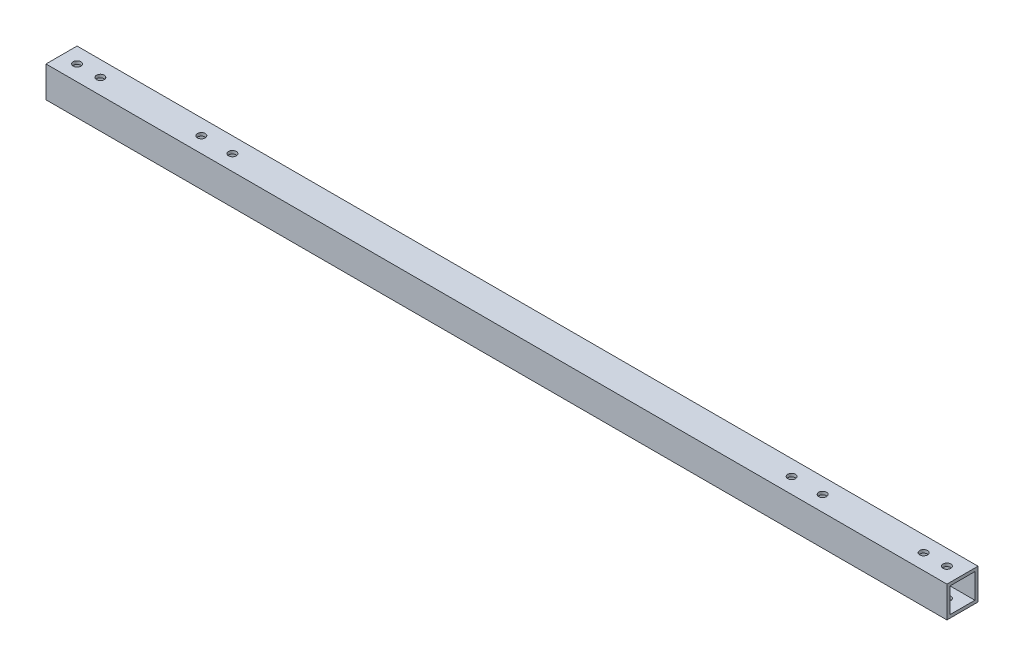
from build123d import *

# Parameters (mm, degrees)
SKETCH1_W           = 20
SKETCH1_H           = 20
SKETCH1_W_2         = 16
SKETCH1_H_2         = 16
BOSS_EXTRUDE1_DEPTH = 580
SKETCH2_R           = 2.5
CUT_EXTRUDE1_DEPTH  = 581.430874437
SKETCH3_R           = 2.5
CUT_EXTRUDE2_DEPTH  = 581.430874437


with BuildPart() as part:
    # Sketch1 → Boss-Extrude1 (new body)
    with BuildSketch(Plane(origin=(0, 0, 0), x_dir=(0, 0, -1), z_dir=(1, 0, 0))):
        Rectangle(SKETCH1_W, SKETCH1_H)
        Rectangle(SKETCH1_W_2, SKETCH1_H_2, mode=Mode.SUBTRACT)
    extrude(amount=BOSS_EXTRUDE1_DEPTH)

    # Sketch2 → Cut-Extrude1 (cut, through all)
    with BuildSketch(Plane(origin=(0, 10, 0), x_dir=(1, 0, 0), z_dir=(0, 1, 0))):
        with Locations(Location((10, 0, 0), (0, 0, 270))):
            Circle(SKETCH2_R)
        with Locations(Location((570, 0, 0), (0, 0, 270))):
            Circle(SKETCH2_R)
        with Locations(Location((25, 0, 0), (0, 0, 270))):
            Circle(SKETCH2_R)
        with Locations(Location((555, 0, 0), (0, 0, 270))):
            Circle(SKETCH2_R)
    extrude(amount=-CUT_EXTRUDE1_DEPTH, mode=Mode.SUBTRACT)

    # Sketch3 → Cut-Extrude2 (cut, through all)
    with BuildSketch(Plane(origin=(0, 10, 0), x_dir=(1, 0, 0), z_dir=(0, 1, 0))):
        with Locations(Location((110, 0, 0), (0, 0, 270))):
            Circle(SKETCH3_R)
        with Locations(Location((90, 0, 0), (0, 0, 270))):
            Circle(SKETCH3_R)
        with Locations(Location((490, 0, 0), (0, 0, 270))):
            Circle(SKETCH3_R)
        with Locations(Location((470, 0, 0), (0, 0, 270))):
            Circle(SKETCH3_R)
    extrude(amount=-CUT_EXTRUDE2_DEPTH, mode=Mode.SUBTRACT)


solid = part.part
